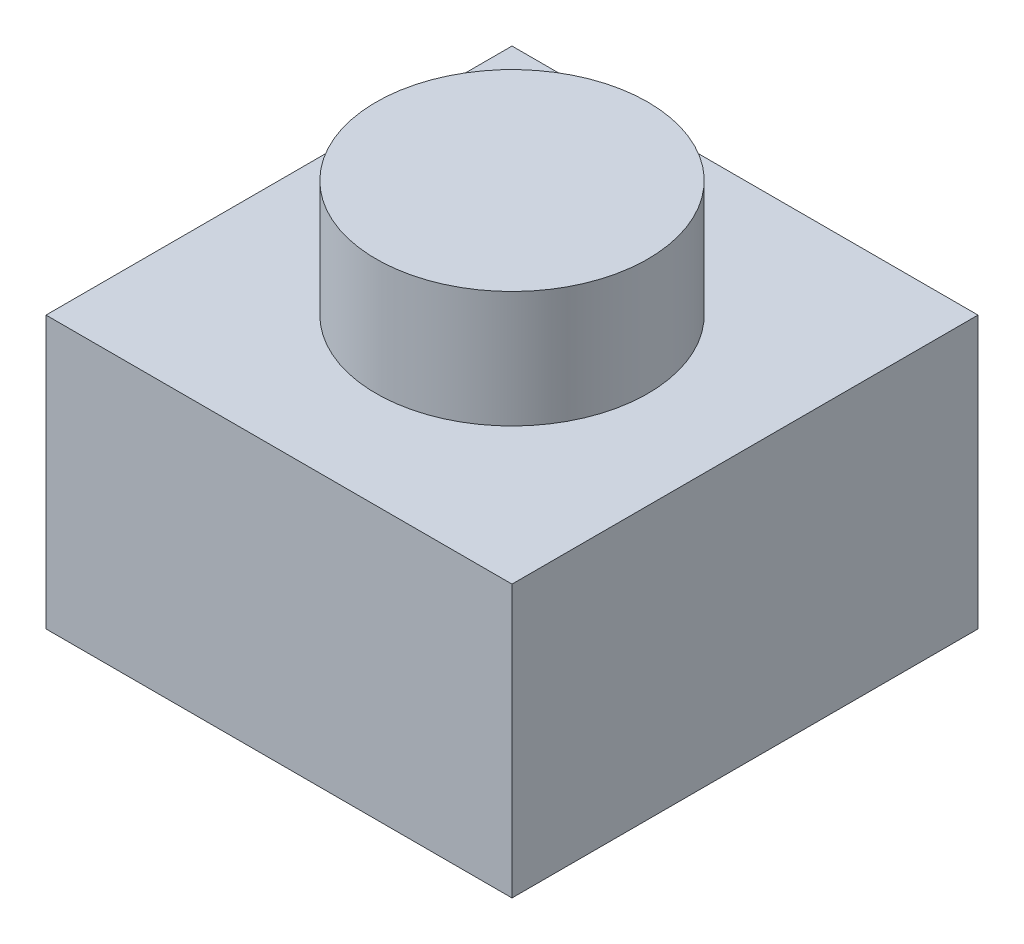
from build123d import *

# Parameters (mm, degrees)
SKETCH1_W           = 6.096
SKETCH1_H           = 6.096
BOSS_EXTRUDE1_DEPTH = 3.556
SKETCH2_R           = 1.778
BOSS_EXTRUDE2_DEPTH = 1.524


with BuildPart() as part:
    # Sketch1 → Boss-Extrude1 (new body)
    with BuildSketch(Plane(origin=(0, 0, 0), x_dir=(1, 0, 0), z_dir=(0, 1, 0))):
        with Locations((3.048, 3.048)):
            Rectangle(SKETCH1_W, SKETCH1_H)
    extrude(amount=BOSS_EXTRUDE1_DEPTH)

    # Sketch2 → Boss-Extrude2 (add)
    with BuildSketch(Plane(origin=(0, 3.556, 0), x_dir=(1, 0, 0), z_dir=(0, 1, 0))):
        with Locations(Location((3.048, 3.048, 0), (0, 0, 90))):
            Circle(SKETCH2_R)
    extrude(amount=BOSS_EXTRUDE2_DEPTH)


solid = part.part
